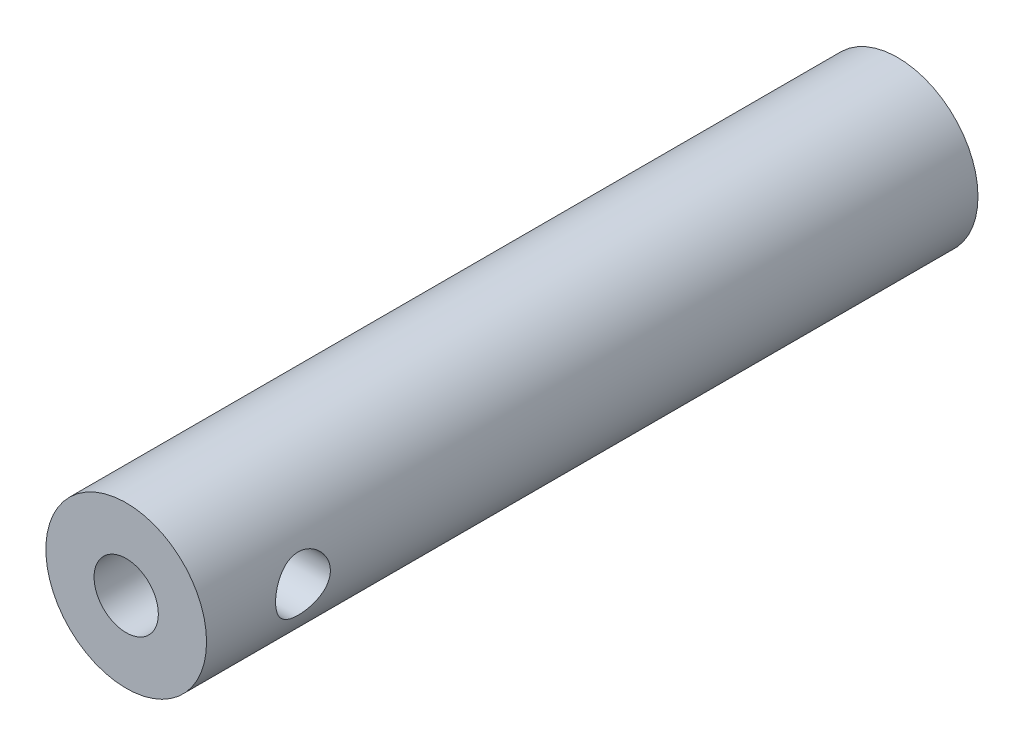
from build123d import *

# Parameters (mm, degrees)
SKETCH1_R                 = 3.96875
BODY_DEPTH                = 38.1
SKETCH1_3_R               = 1.5875
POT_SHAFT_OPENING_DEPTH   = 15.24
F_6_32_TAPPED_HOLE1_D     = 2.7051
F_6_32_TAPPED_HOLE1_DEPTH = 3.81
F_6_32_TAPPED_HOLE1_TIP   = 0.81269403


with BuildPart() as part:
    # Sketch1 → Body (new body)
    with BuildSketch(Plane.XY):
        Circle(SKETCH1_R)
    extrude(amount=-BODY_DEPTH)

    # Sketch1<3> → POT Shaft Opening (cut)
    with BuildSketch(Plane.XY):
        Circle(SKETCH1_3_R)
    extrude(amount=-POT_SHAFT_OPENING_DEPTH, mode=Mode.SUBTRACT)

    # #6-32 Tapped Hole1
    with Locations(Plane(origin=(3.96875, 0, 0), x_dir=(0, 0, -1), z_dir=(1, 0, 0))):
        with Locations((4.7625, 0)):
            Hole(F_6_32_TAPPED_HOLE1_D / 2, depth=F_6_32_TAPPED_HOLE1_DEPTH)
            with Locations((0, 0, -(F_6_32_TAPPED_HOLE1_DEPTH + F_6_32_TAPPED_HOLE1_TIP / 2))):  # 118° drill point
                Cone(0, F_6_32_TAPPED_HOLE1_D / 2, F_6_32_TAPPED_HOLE1_TIP, mode=Mode.SUBTRACT)


solid = part.part
